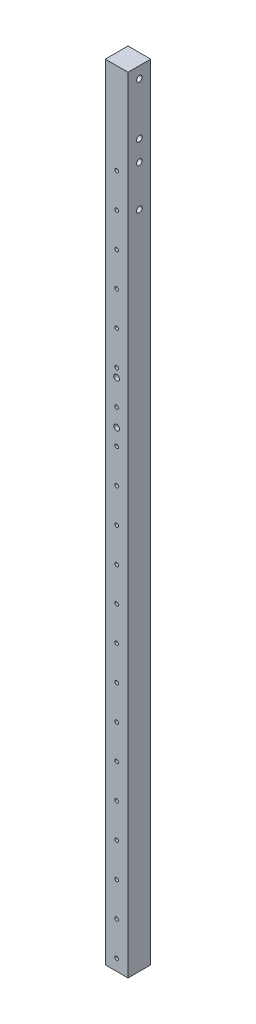
from build123d import *

# Parameters (mm, degrees)
ESQUISSE1_W               = 10
ESQUISSE1_H               = 10
BOSS_EXTRU_1_DEPTH        = 345
TROU_TARAUD_M3X0_51_D     = 2.5
TROU_TARAUD_M2X0_41_D     = 1.6
TROU_TARAUD_M2X0_41_DEPTH = 6
TROU_TARAUD_M3X0_52_D     = 2.5


with BuildPart() as part:
    # Esquisse1 → Boss.-Extru.1 (new body)
    with BuildSketch(Plane(origin=(0, 0, 0), x_dir=(1, 0, 0), z_dir=(0, 1, 0))):
        Rectangle(ESQUISSE1_W, ESQUISSE1_H)
    extrude(amount=BOSS_EXTRU_1_DEPTH)

    # Trou taraudé M3x0.51 (through all)
    with Locations(Plane.ZY.offset(5)):
        with Locations((0, 340), (0, 317.2), (0, 308.2), (0, 290.2)):
            Hole(TROU_TARAUD_M3X0_51_D / 2)

    # Trou taraudé M2x0.41
    with Locations(Plane.XY.offset(5)):
        with Locations((0, 5), (0, 20), (0, 35), (0, 50), (0, 65), (0, 80), (0, 95), (0, 110), (0, 125), (0, 140), (0, 155), (0, 170), (0, 185), (0, 200), (0, 215), (0, 230), (0, 245), (0, 260), (0, 290), (0, 275), (0, 305)):
            Hole(TROU_TARAUD_M2X0_41_D / 2, depth=TROU_TARAUD_M2X0_41_DEPTH)

    # Trou taraudé M3x0.52 (through all)
    with Locations(Plane(origin=(0, 0, -5), x_dir=(-1, 0, 0), z_dir=(0, 0, -1))):
        with Locations((0, 226.2), (0, 207.2)):
            Hole(TROU_TARAUD_M3X0_52_D / 2)


solid = part.part
